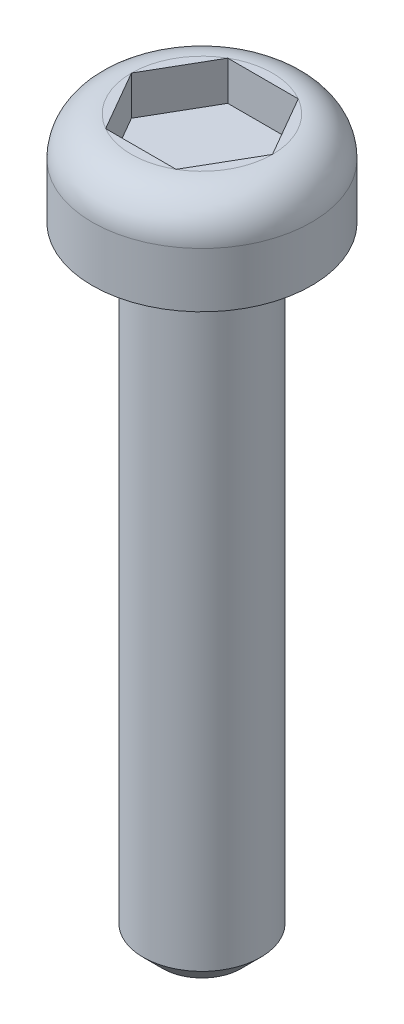
from build123d import *

# Parameters (mm, degrees)
SKETCH1_R           = 1.5
BOSS_EXTRUDE1_DEPTH = 16
SKETCH2_R           = 2.8
BOSS_EXTRUDE2_DEPTH = 2.4
FILLET1_R           = 1
CUT_EXTRUDE1_DEPTH  = 1
CHAMFER1_SIZE       = 0.5


with BuildPart() as part:
    # Sketch1 → Boss-Extrude1 (new body)
    with BuildSketch(Plane(origin=(0, 0, 0), x_dir=(1, 0, 0), z_dir=(0, 1, 0))):
        with Locations(Location((0, 0, 0), (0, 0, 270))):
            Circle(SKETCH1_R)
    extrude(amount=BOSS_EXTRUDE1_DEPTH)

    # Sketch2 → Boss-Extrude2 (add)
    with BuildSketch(Plane(origin=(0, 16, 0), x_dir=(1, 0, 0), z_dir=(0, 1, 0))):
        with Locations(Location((0, 0, 0), (0, 0, 270))):
            Circle(SKETCH2_R)
    extrude(amount=BOSS_EXTRUDE2_DEPTH)

    # Fillet1
    fillet1_edges = [part.edges().sort_by_distance(p)[0] for p in [
        (0, 18.4, -2.8),
    ]]
    fillet(fillet1_edges, radius=FILLET1_R)

    # Sketch3 → Cut-Extrude1 (cut)
    with BuildSketch(Plane(origin=(0, 18.4, 0), x_dir=(1, 0, 0), z_dir=(0, 1, 0))):
        Polygon((1.8, 0), (0.9, 1.558845727), (-0.9, 1.558845727), (-1.8, 0), (-0.9, -1.558845727), (0.9, -1.558845727), align=None)
    extrude(amount=-CUT_EXTRUDE1_DEPTH, mode=Mode.SUBTRACT)

    # Chamfer1
    chamfer1_edges = [part.edges().sort_by_distance(p)[0] for p in [
        (0, 0, -1.5),
    ]]
    chamfer(chamfer1_edges, length=CHAMFER1_SIZE)


solid = part.part
